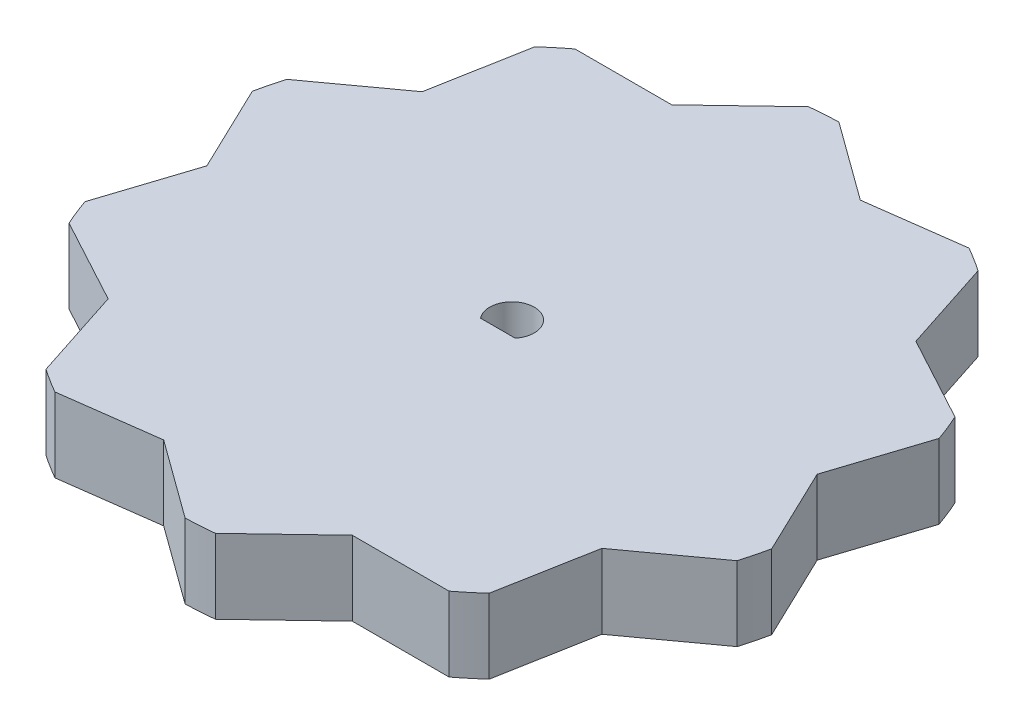
from build123d import *

# Parameters (mm, degrees)
SKETCH1_R               = 22.5
BOSS_EXTRUDE1_DEPTH     = 5
CUT_EXTRUDE1_DEPTH      = 4
CUT_EXTRUDE6_DEPTH      = 33.210246817
CUT_EXTRUDE6_DEPTH_BACK = 33.210246817
CUT_EXTRUDE7_START      = -1
SKETCH5_R               = 1.5
CUT_EXTRUDE7_DEPTH      = 1
CRVPATTERN3_COUNT       = 10


with BuildPart() as part:
    # Sketch1 → Boss-Extrude1 (new body)
    with BuildSketch(Plane(origin=(0, 0, 0), x_dir=(1, 0, 0), z_dir=(0, 1, 0))):
        with Locations(Location((0, 0, 0), (0, 0, 270))):
            Circle(SKETCH1_R)
    extrude(amount=BOSS_EXTRUDE1_DEPTH)

    # Sketch2 → Cut-Extrude1 (cut)
    with BuildSketch(Plane(origin=(0, 5, 0), x_dir=(1, 0, 0), z_dir=(0, 1, 0))):
        with BuildLine():
            Line((-1.160818677, -0.95), (1.160818677, -0.95))
            ThreePointArc((1.160818677, -0.95), (0, 1.5), (-1.160818677, -0.95))
        make_face()
    extrude(amount=-CUT_EXTRUDE1_DEPTH, mode=Mode.SUBTRACT)

    # Sketch4 → Cut-Extrude6 (cut, two sides: drawn at the far end of the back side and taken through both)
    with BuildSketch(Plane(origin=(0, 5, 0), x_dir=(1, 0, 0), z_dir=(0, 1, 0)).offset(-CUT_EXTRUDE6_DEPTH_BACK)):
        Polygon((83.285175452, 104.034655768), (-2.447970935, 22.36643553), (-7.154384821, 17.883170165), (-13.654384821, 17.883170165), (-132.059919263, 17.883170165), (-220.021178565, 237.751992892), (-4.67608385, 323.903478495), align=None)
    cut_extrude6 = extrude(amount=CUT_EXTRUDE6_DEPTH + CUT_EXTRUDE6_DEPTH_BACK, mode=Mode.SUBTRACT)

    # Sketch5 → Cut-Extrude7 (cut)
    with BuildSketch(Plane.XZ.offset(CUT_EXTRUDE7_START)):
        with Locations(Location((0, 0, 0), (0, 0, 39.296480239))):
            Circle(SKETCH5_R)
    extrude(amount=CUT_EXTRUDE7_DEPTH, mode=Mode.SUBTRACT)

    # CrvPattern3: Cut-Extrude6 ×10 about axis
    crvpattern3_axis = Axis((0, 0, 0), (0, -1, 0))
    for i in range(1, CRVPATTERN3_COUNT):
        add(cut_extrude6.rotate(crvpattern3_axis, i * 360 / CRVPATTERN3_COUNT), mode=Mode.SUBTRACT)


solid = part.part
